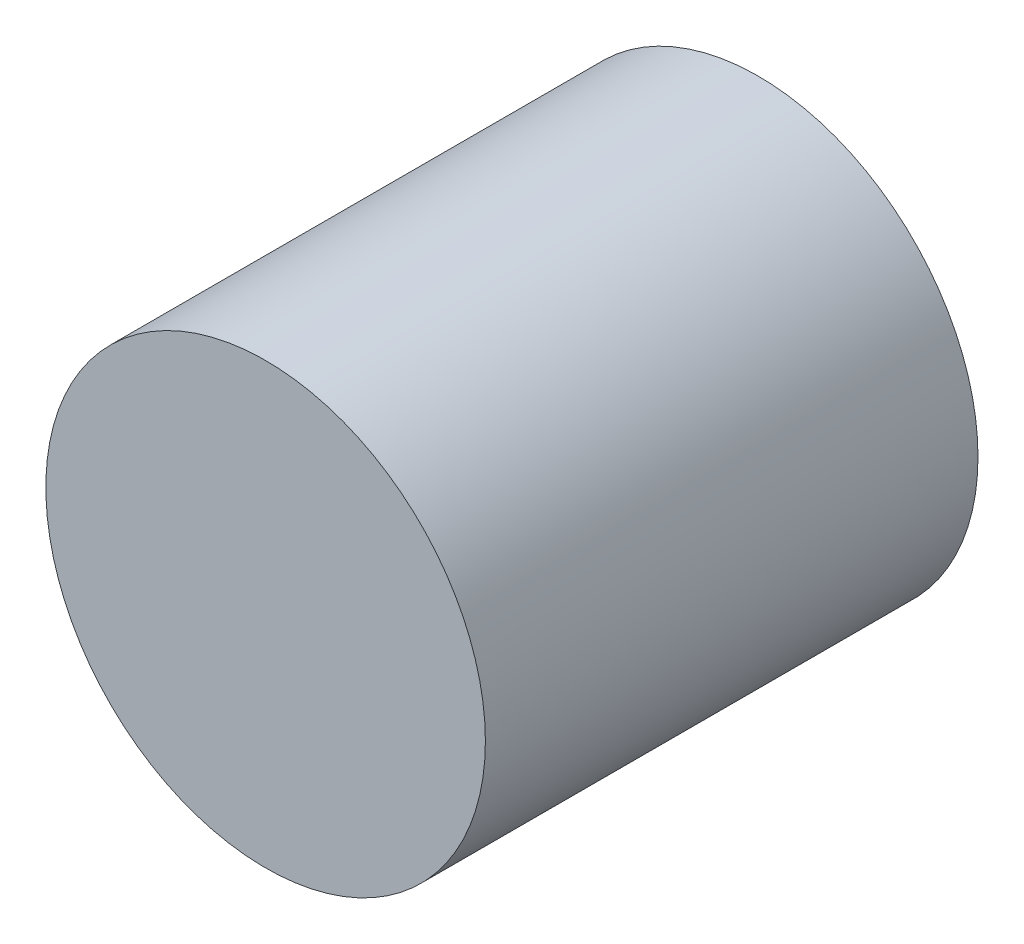
from build123d import *

# Parameters (mm, degrees)
SZKIC1_R                    = 2.9
DODANIE_WYCI_GNI_CIE1_DEPTH = 6
SZKIC2_R                    = 1.6
WYTNIJ_WYCI_GNI_CIE1_DEPTH  = 6
SZKIC3_R                    = 2.9
DODANIE_WYCI_GNI_CIE2_DEPTH = 0.5


with BuildPart() as part:
    # Szkic1 → Dodanie-wyciągnięcie1 (new body)
    with BuildSketch(Plane.XY):
        Circle(SZKIC1_R)
    extrude(amount=DODANIE_WYCI_GNI_CIE1_DEPTH)

    # Szkic2 → Wytnij-wyciągnięcie1 (cut)
    with BuildSketch(Plane.XY.offset(6)):
        Circle(SZKIC2_R)
    extrude(amount=-WYTNIJ_WYCI_GNI_CIE1_DEPTH, mode=Mode.SUBTRACT)

    # Szkic3 → Dodanie-wyciągnięcie2 (add)
    with BuildSketch(Plane.XY.offset(6)):
        Circle(SZKIC3_R)
    extrude(amount=DODANIE_WYCI_GNI_CIE2_DEPTH)


solid = part.part
